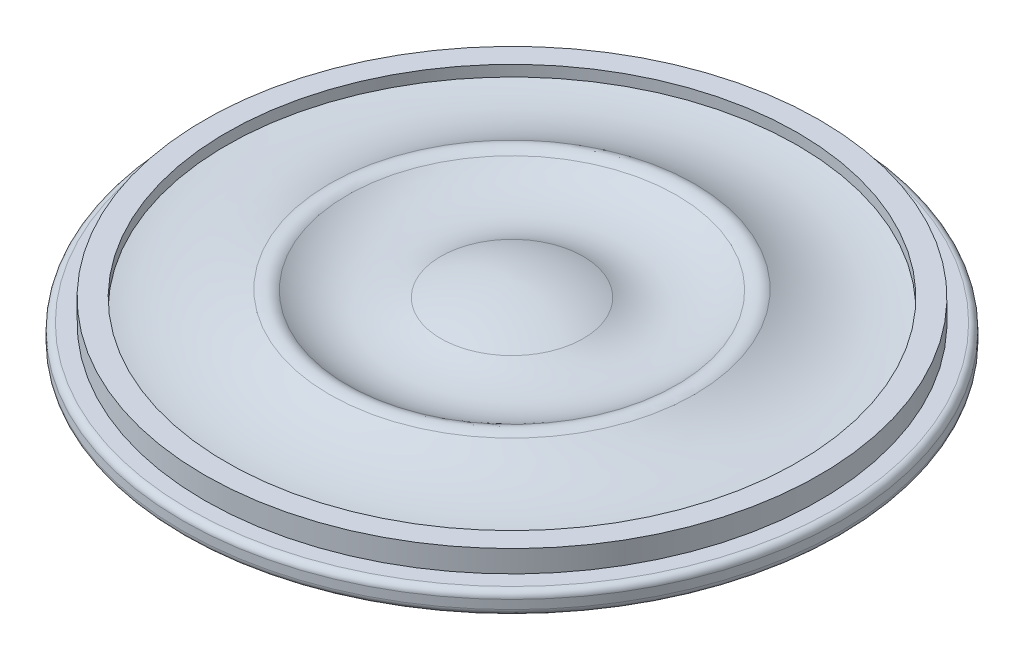
from build123d import *

# Parameters (mm, degrees)
ESQUISSE2_R                  = 1.266989932
ENL_V_MAT_EXTRU_1_DEPTH      = 1
R_P_TITION_CIRCULAIRE1_COUNT = 12
CONG_1_R                     = 0.3


with BuildPart() as part:
    # Esquisse1 → Révolution1 (revolve)
    with BuildSketch(Plane.XY):
        with BuildLine():
            Line((0, 0), (8, 0))
            Line((8, 0), (8, 1.5))
            Line((8, 1.5), (13, 1.5))
            Line((13, 1.5), (13, 2))
            Line((13, 2), (15, 2))
            Line((15, 2), (15, 3))
            Line((15, 3), (14, 3))
            Line((14, 3), (14, 4))
            Line((14, 4), (13, 4))
            Line((13, 4), (13, 3.5))
            ThreePointArc((13, 3.5), (10.580856411, 3.49469197), (8.31022741, 4.329274392))
            ThreePointArc((8.31022741, 4.329274392), (7.895139016, 4.43156332), (7.491263177, 4.291400178))
            ThreePointArc((7.491263177, 4.291400178), (5.408463785, 3.542487021), (3.242913948, 4))
            ThreePointArc((3.242913948, 4), (1.653714853, 4.49944218), (0, 4.7))
            Line((0, 4.7), (0, 0))
        make_face()
    revolve(axis=Axis((0, 0, 0), (0, 1, 0)))

    # Esquisse2 → Enlèv. mat.-Extru.1 (cut)
    with BuildSketch(Plane.XZ.offset(-1.5)):
        with Locations((-4.926700853, 9.484629088)):
            Circle(ESQUISSE2_R)
    enl_v_mat_extru_1 = extrude(amount=-ENL_V_MAT_EXTRU_1_DEPTH, mode=Mode.SUBTRACT)

    # Répétition circulaire1: Enlèv. mat.-Extru.1 ×12 about axis
    r_p_tition_circulaire1_axis = Axis((0, -0.235, 0), (0, 1, 0))
    for i in range(1, R_P_TITION_CIRCULAIRE1_COUNT):
        add(enl_v_mat_extru_1.rotate(r_p_tition_circulaire1_axis, i * 360 / R_P_TITION_CIRCULAIRE1_COUNT), mode=Mode.SUBTRACT)

    # Congé1
    cong_1_edges = [part.edges().sort_by_distance(p)[0] for p in [
        (-15, 3, 0),
        (-15, 2, 0),
        (-13, 1.5, 0),
        (-8, 0, 0),
    ]]
    fillet(cong_1_edges, radius=CONG_1_R)


solid = part.part
